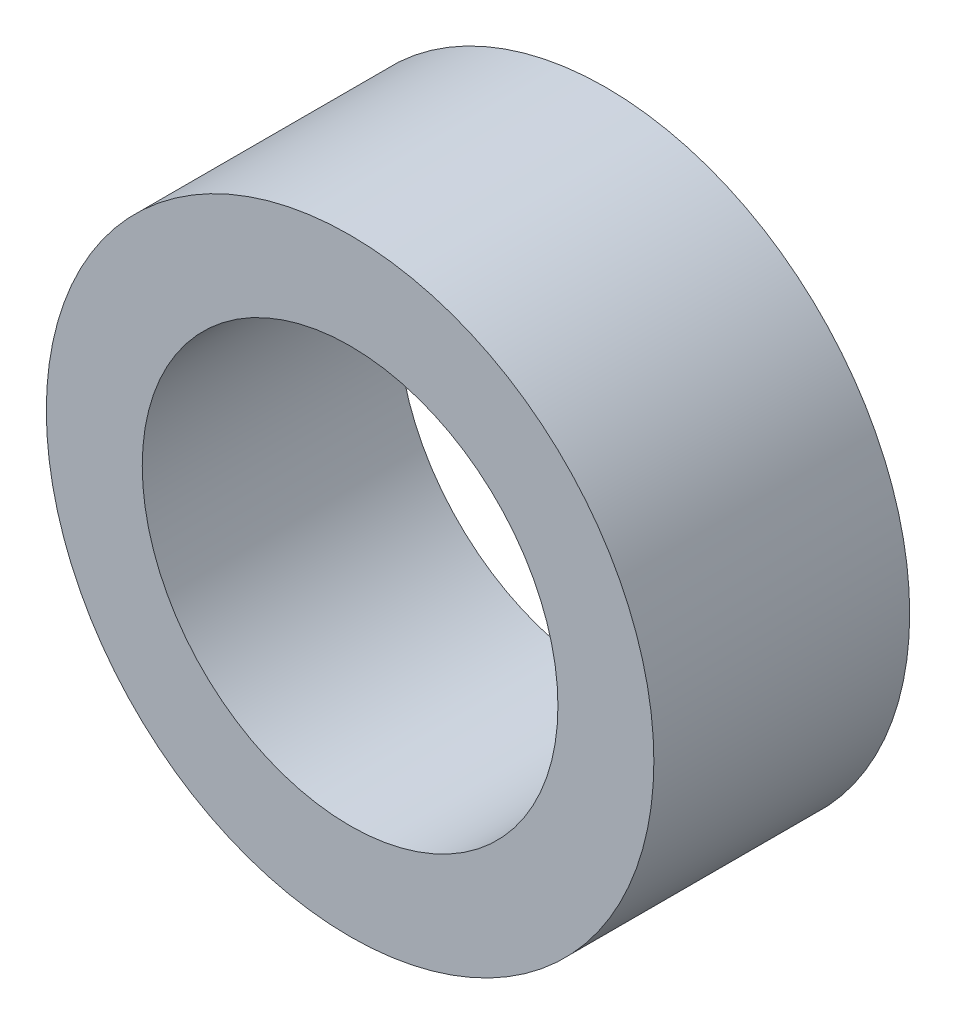
from build123d import *

# Parameters (mm, degrees)
SKETCH_1_R      = 4.75
SKETCH_1_R_2    = 3.25
EXTRUDE_1_DEPTH = 4


with BuildPart() as part:
    # 草图1 → 凸台-拉伸1 (new body)
    with BuildSketch(Plane.XY):
        Circle(SKETCH_1_R)
        Circle(SKETCH_1_R_2, mode=Mode.SUBTRACT)
    extrude(amount=EXTRUDE_1_DEPTH)


solid = part.part
